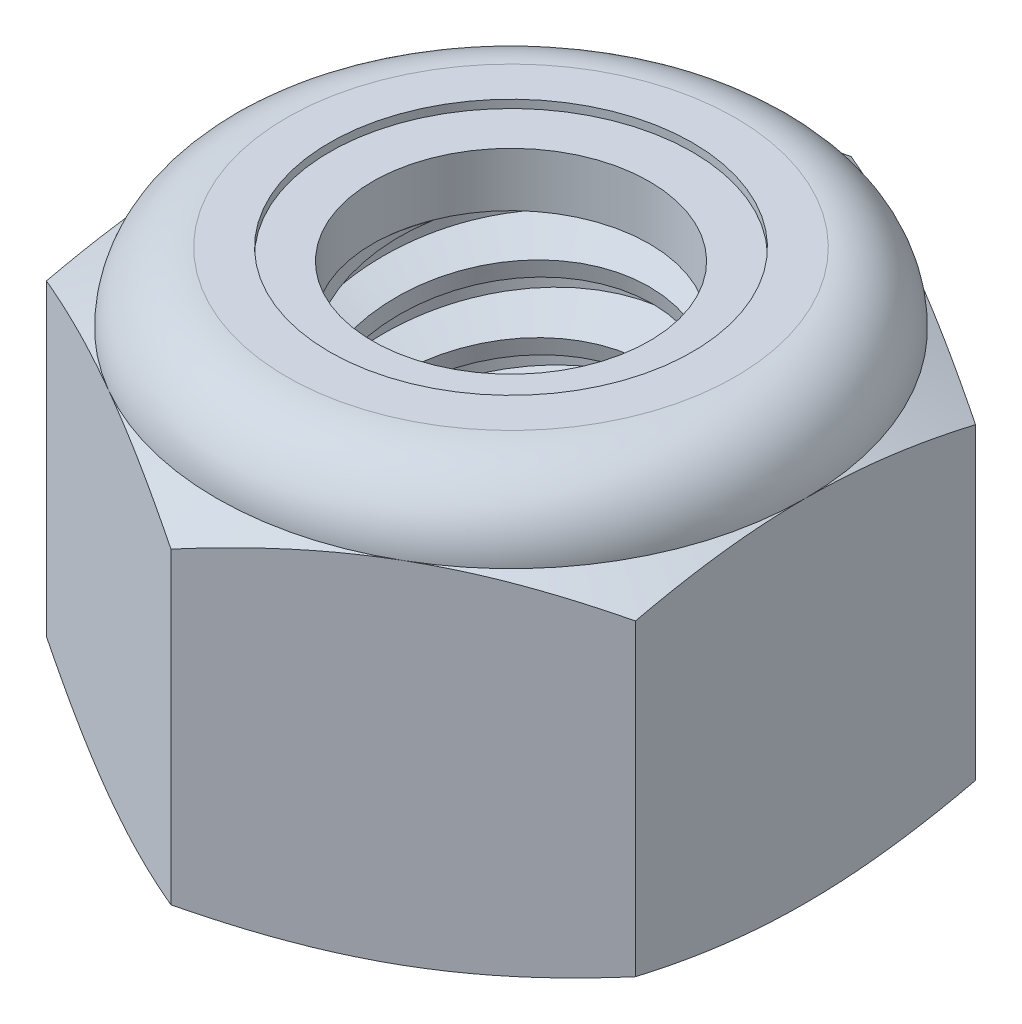
from build123d import *

# Parameters (mm, degrees)
EXTRUDE1_DEPTH       = 7.9375
SKETCH2_W            = 3.175
SKETCH2_H            = 7.9375
LPATTERN1_COUNT      = 6
LPATTERN1_PITCH      = 1.27
LPATTERN1_COUNT_DIR2 = 2
LPATTERN1_PITCH_DIR2 = 1.27


with BuildPart() as part:
    # Sketch1 → Extrude1 (new body)
    with BuildSketch(Plane(origin=(0, 0, 0), x_dir=(1, 0, 0), z_dir=(0, 1, 0))):
        Polygon((0, 6.415804866), (-5.55625, 3.207902433), (-5.55625, -3.207902433), (0, -6.415804866), (5.55625, -3.207902433), (5.55625, 3.207902433), align=None)
    extrude(amount=EXTRUDE1_DEPTH)

    # Sketch4 → Cut-Revolve2 (revolve, cut)
    with BuildSketch(Plane(origin=(0, 0, 0), x_dir=(0, 0, -1), z_dir=(1, 0, 0))):
        Polygon((0, 7.9375), (3.175, 7.9375), (2.609908356, 7.673993439), (2.609908356, 0.263506561), (3.175, 0), (0, 0), align=None)
    revolve(axis=Axis((0, 7.9375, 0), (0, 1, 0)), mode=Mode.SUBTRACT)


with BuildPart() as body_2:
    # Sketch2 → Revolve1 (revolve)
    with BuildSketch(Plane(origin=(0, 0, 0), x_dir=(0, 0, -1), z_dir=(1, 0, 0))):
        with Locations((1.5875, 3.96875)):
            Rectangle(SKETCH2_W, SKETCH2_H)
    revolve(axis=Axis((0, -3.175, 0), (0, 1, 0)))

    # Sketch3 → Cut-Revolve1 (revolve, cut)
    with BuildSketch(Plane(origin=(0, 0, 0), x_dir=(0, 0, -1), z_dir=(1, 0, 0))):
        Polygon((3.206133436, 7.781832818), (3.424067492, 6.692162542), (2.672175229, 6.946518763), (2.609908356, 7.257853128), align=None)
    cut_revolve1 = revolve(axis=Axis((0, 7.9375, 0.272704483), (0, -0.9805806756909201, -0.19611613513818413)), mode=Mode.SUBTRACT)

    # LPattern1: Cut-Revolve1 6 × 2
    with Locations(*[Vector(0, -1, 0) * (i * LPATTERN1_PITCH) + Vector(0, 1, 0) * (j * LPATTERN1_PITCH_DIR2) for i in range(LPATTERN1_COUNT) for j in range(LPATTERN1_COUNT_DIR2) if (i, j) != (0, 0)]):
        add(cut_revolve1, mode=Mode.SUBTRACT)


with BuildPart() as part_1:
    add(part.part)

    # Combine1: cut body 2
    add(body_2.part, mode=Mode.SUBTRACT)

    # Sketch5 → Cut-Revolve3 (revolve, cut)
    with BuildSketch(Plane(origin=(0, 0, 0), x_dir=(0, 0, -1), z_dir=(1, 0, 0))):
        with BuildLine():
            Line((0, 0), (5.55625, 0))
            Line((5.55625, 0), (6.415804866, 0.400817017))
            Line((6.415804866, 0.400817017), (6.415804866, 6.213766317))
            Line((6.415804866, 6.213766317), (5.55625, 6.614583333))
            ThreePointArc((5.55625, 6.614583333), (5.168776679, 7.550026679), (4.233333333, 7.9375))
            Line((4.233333333, 7.9375), (4.233333333, 9.2075))
            Line((4.233333333, 9.2075), (7.685804866, 9.2075))
            Line((7.685804866, 9.2075), (7.685804866, -1.27))
            Line((7.685804866, -1.27), (0, -1.27))
            Line((0, -1.27), (0, 0))
        make_face()
    revolve(axis=Axis((0, 0, 0), (0, 1, 0)), mode=Mode.SUBTRACT)

    # Sketch6 → Cut-Revolve4 (revolve, cut)
    with BuildSketch(Plane(origin=(0, 0, 0), x_dir=(0, 0, -1), z_dir=(1, 0, 0))):
        with BuildLine():
            Line((0, 6.614583333), (5.40385, 6.614583333))
            ThreePointArc((5.40385, 6.614583333), (5.061013606, 7.442263606), (4.233333333, 7.7851))
            Line((4.233333333, 7.7851), (3.421620845, 7.7851))
            Line((3.421620845, 7.7851), (3.421620845, 9.2075))
            Line((3.421620845, 9.2075), (0, 9.2075))
            Line((0, 9.2075), (0, 6.614583333))
        make_face()
    revolve(axis=Axis((0, 9.2075, 0), (0, 1, 0)), mode=Mode.SUBTRACT)


with BuildPart() as body_2_2:
    # Sketch7 → Revolve2 (revolve)
    with BuildSketch(Plane(origin=(0, 0, 0), x_dir=(0, 0, -1), z_dir=(1, 0, 0))):
        with BuildLine():
            Line((2.609908356, 6.690783333), (5.324993778, 6.690783333))
            ThreePointArc((5.324993778, 6.690783333), (4.979705237, 7.4148695), (4.233333333, 7.7089))
            Line((4.233333333, 7.7089), (2.609908356, 7.7089))
            Line((2.609908356, 7.7089), (2.609908356, 6.690783333))
        make_face()
    revolve(axis=Axis((0, 6.690783333, 0), (0, 1, 0)))


solid = Compound([part_1.part, body_2_2.part])
